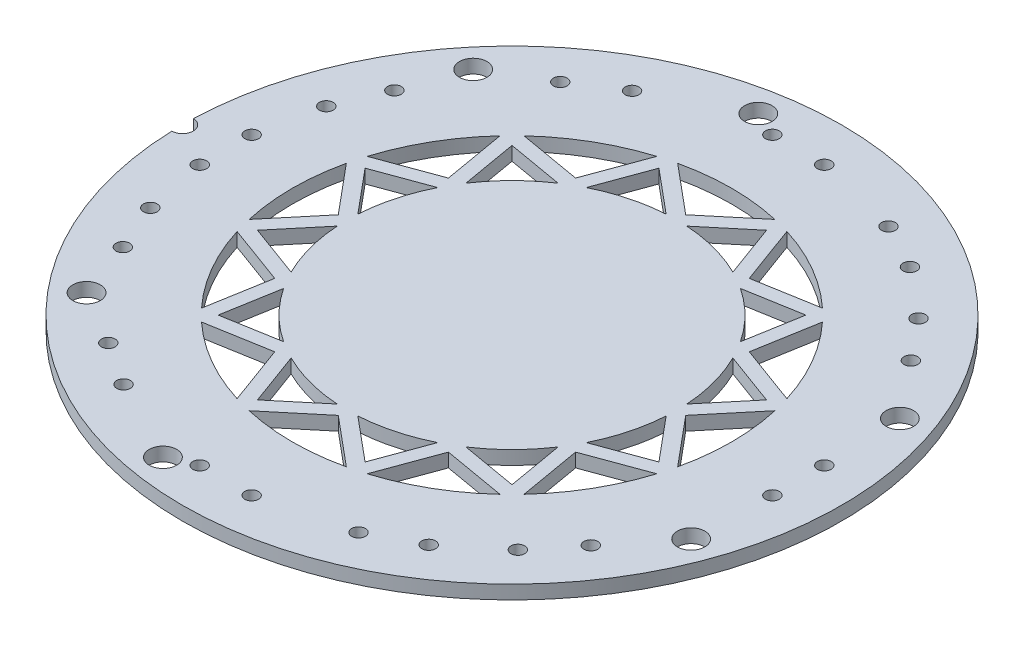
from build123d import *

# Parameters (mm, degrees)
SKETCH2_R                = 88.9
BOSS_EXTRUDE1_DEPTH      = 3.175
SKETCH3_R                = 3.175
CUT_EXTRUDE1_DEPTH       = 3.175
SKETCH6_R                = 88.9
SKETCH6_R_2              = 76.2
CUT_EXTRUDE2_DEPTH       = 126.763669734
SKETCH7_R                = 1.5875
CUT_EXTRUDE3_DEPTH       = 108.809835474
SKETCH8_R                = 2.5
CUT_EXTRUDE4_DEPTH       = 108.809835474
CIRPATTERN1_COUNT        = 2
CIRPATTERN1_ANGLE        = 23
CIRPATTERN2_COUNT        = 2
CIRPATTERN2_ANGLE        = 57
CIRPATTERN3_COUNT        = 2
CIRPATTERN3_ANGLE        = 90
CIRPATTERN4_COUNT        = 2
CIRPATTERN6_COUNT        = 2
CIRPATTERN6_ANGLE        = 141
CIRPATTERN7_COUNT        = 2
CIRPATTERN7_ANGLE        = 118
MIRROR3_COPY_1_SKETCH_R  = 1.5875
MIRROR3_COPY_1_DEPTH     = 108.809835474
MIRROR3_COPY_2_SKETCH_R  = 1.5875
MIRROR3_COPY_2_DEPTH     = 108.809835474
MIRROR3_COPY_3_SKETCH_R  = 1.5875
MIRROR3_COPY_3_DEPTH     = 108.809835474
MIRROR3_COPY_4_SKETCH_R  = 1.5875
MIRROR3_COPY_4_DEPTH     = 108.809835474
MIRROR3_COPY_5_SKETCH_R  = 1.5875
MIRROR3_COPY_5_DEPTH     = 108.809835474
MIRROR3_COPY_6_SKETCH_R  = 1.5875
MIRROR3_COPY_6_DEPTH     = 108.809835474
MIRROR3_COPY_7_SKETCH_R  = 1.5875
MIRROR3_COPY_7_DEPTH     = 108.809835474
MIRROR3_COPY_8_SKETCH_R  = 1.5875
MIRROR3_COPY_8_DEPTH     = 108.809835474
MIRROR3_COPY_9_SKETCH_R  = 1.5875
MIRROR3_COPY_9_DEPTH     = 108.809835474
MIRROR3_COPY_10_SKETCH_R = 1.5875
MIRROR3_COPY_10_DEPTH    = 108.809835474
SKETCH11_R               = 50.8
SKETCH11_R_2             = 38.1
CUT_EXTRUDE6_DEPTH       = 108.809835474
EXTRUDE_THIN2_DEPTH      = 3.175


with BuildPart() as part:
    # Sketch2 → Boss-Extrude1 (new body)
    with BuildSketch(Plane(origin=(0, 0, 0), x_dir=(1, 0, 0), z_dir=(0, 1, 0))):
        with Locations(Location((0, 0, 0), (0, 0, 270))):
            Circle(SKETCH2_R)
    extrude(amount=BOSS_EXTRUDE1_DEPTH)

    # Sketch3 → Cut-Extrude1 (cut)
    with BuildSketch(Plane(origin=(0, 3.175, 0), x_dir=(1, 0, 0), z_dir=(0, 1, 0))):
        with Locations(Location((65.549718535, -24.13, 0), (0, 0, 270))):
            Circle(SKETCH3_R)
        with Locations(Location((65.549718535, 24.13, 0), (0, 0, 270))):
            Circle(SKETCH3_R)
        with Locations(Location((-53.672052261, 44.702721462, 0), (0, 0, 270))):
            Circle(SKETCH3_R)
        with Locations(Location((-11.877666274, 68.832721462, 0), (0, 0, 270))):
            Circle(SKETCH3_R)
        with Locations(Location((-11.877666274, -68.832721462, 0), (0, 0, 270))):
            Circle(SKETCH3_R)
        with Locations(Location((-53.672052261, -44.702721462, 0), (0, 0, 270))):
            Circle(SKETCH3_R)
    extrude(amount=-CUT_EXTRUDE1_DEPTH, mode=Mode.SUBTRACT)

    # Sketch6 → Cut-Extrude2 (cut, through all)
    with BuildSketch(Plane(origin=(0, 3.175, 0), x_dir=(1, 0, 0), z_dir=(0, 1, 0))):
        Circle(SKETCH6_R)
        with Locations(Location((0, 0, 0), (0, 0, 270))):
            Circle(SKETCH6_R_2, mode=Mode.SUBTRACT)
    extrude(amount=-CUT_EXTRUDE2_DEPTH, mode=Mode.SUBTRACT)

    # Sketch7 → Cut-Extrude3 (cut, symmetric)
    with BuildSketch(Plane(origin=(0, 3.175, 0), x_dir=(1, 0, 0), z_dir=(0, 1, 0))):
        with Locations(Location((-66.2, 6, 0), (0, 0, 270))):
            Circle(SKETCH7_R)
        with Locations(Location((-66.2, -6, 0), (0, 0, 270))):
            Circle(SKETCH7_R)
    cut_extrude3 = extrude(amount=CUT_EXTRUDE3_DEPTH, both=True, mode=Mode.SUBTRACT)

    # Sketch8 → Cut-Extrude4 (cut, through all)
    with BuildSketch(Plane(origin=(0, 3.175, 0), x_dir=(1, 0, 0), z_dir=(0, 1, 0))):
        with Locations((-76.2, 0)):
            Circle(SKETCH8_R)
    extrude(amount=-CUT_EXTRUDE4_DEPTH, mode=Mode.SUBTRACT)

    # CirPattern1: Cut-Extrude3 ×2 about axis
    cirpattern1_axis = Axis((0, 0, 0), (0, 1, 0))
    for i in range(1, CIRPATTERN1_COUNT):
        add(cut_extrude3.rotate(cirpattern1_axis, i * CIRPATTERN1_ANGLE / (CIRPATTERN1_COUNT - 1)), mode=Mode.SUBTRACT)

    # CirPattern2: Cut-Extrude3 ×2 about axis
    cirpattern2_axis = Axis((0, 0, 0), (0, 1, 0))
    for i in range(1, CIRPATTERN2_COUNT):
        add(cut_extrude3.rotate(cirpattern2_axis, i * CIRPATTERN2_ANGLE / (CIRPATTERN2_COUNT - 1)), mode=Mode.SUBTRACT)

    # CirPattern3: Cut-Extrude3 ×2 about axis
    cirpattern3_axis = Axis((0, 0, 0), (0, 1, 0))
    for i in range(1, CIRPATTERN3_COUNT):
        add(cut_extrude3.rotate(cirpattern3_axis, i * CIRPATTERN3_ANGLE / (CIRPATTERN3_COUNT - 1)), mode=Mode.SUBTRACT)

    # CirPattern4: Cut-Extrude3 ×2 about axis
    cirpattern4_axis = Axis((0, 0, 0), (0, 1, 0))
    for i in range(1, CIRPATTERN4_COUNT):
        add(cut_extrude3.rotate(cirpattern4_axis, i * 360 / CIRPATTERN4_COUNT), mode=Mode.SUBTRACT)

    # CirPattern6: Cut-Extrude3 ×2 about axis
    cirpattern6_axis = Axis((0, 0, 0), (0, 1, 0))
    for i in range(1, CIRPATTERN6_COUNT):
        add(cut_extrude3.rotate(cirpattern6_axis, i * CIRPATTERN6_ANGLE / (CIRPATTERN6_COUNT - 1)), mode=Mode.SUBTRACT)

    # CirPattern7: Cut-Extrude3 ×2 about axis
    cirpattern7_axis = Axis((0, 0, 0), (0, 1, 0))
    for i in range(1, CIRPATTERN7_COUNT):
        add(cut_extrude3.rotate(cirpattern7_axis, i * CIRPATTERN7_ANGLE / (CIRPATTERN7_COUNT - 1)), mode=Mode.SUBTRACT)

    # Mirror3 copy 1 sketch → Mirror3 copy 1 (cut, symmetric)
    with BuildSketch(Plane(origin=(0, 3.175, 0), x_dir=(0.9205048534524399, 0, 0.3907311284892746), z_dir=(0, 1, 0))):
        with Locations((-66.2, -6)):
            Circle(MIRROR3_COPY_1_SKETCH_R)
        with Locations((-66.2, 6)):
            Circle(MIRROR3_COPY_1_SKETCH_R)
    extrude(amount=MIRROR3_COPY_1_DEPTH, both=True, mode=Mode.SUBTRACT)

    # Mirror3 copy 2 sketch → Mirror3 copy 2 (cut, symmetric)
    with BuildSketch(Plane(origin=(0, 3.175, 0), x_dir=(1, 0, 0), z_dir=(0, 1, 0))):
        with Locations((-66.2, -6)):
            Circle(MIRROR3_COPY_2_SKETCH_R)
        with Locations((-66.2, 6)):
            Circle(MIRROR3_COPY_2_SKETCH_R)
    extrude(amount=MIRROR3_COPY_2_DEPTH, both=True, mode=Mode.SUBTRACT)

    # Mirror3 copy 3 sketch → Mirror3 copy 3 (cut, symmetric)
    with BuildSketch(Plane(origin=(0, 3.175, 0), x_dir=(0.5446390350150256, 0, 0.8386705679454249), z_dir=(0, 1, 0))):
        with Locations((-66.2, -6)):
            Circle(MIRROR3_COPY_3_SKETCH_R)
        with Locations((-66.2, 6)):
            Circle(MIRROR3_COPY_3_SKETCH_R)
    extrude(amount=MIRROR3_COPY_3_DEPTH, both=True, mode=Mode.SUBTRACT)

    # Mirror3 copy 4 sketch → Mirror3 copy 4 (cut, symmetric)
    with BuildSketch(Plane(origin=(0, 3.175, 0), x_dir=(1, 0, 0), z_dir=(0, 1, 0))):
        with Locations((-66.2, -6)):
            Circle(MIRROR3_COPY_4_SKETCH_R)
        with Locations((-66.2, 6)):
            Circle(MIRROR3_COPY_4_SKETCH_R)
    extrude(amount=MIRROR3_COPY_4_DEPTH, both=True, mode=Mode.SUBTRACT)

    # Mirror3 copy 5 sketch → Mirror3 copy 5 (cut, symmetric)
    with BuildSketch(Plane.ZX.offset(3.175)):
        with Locations((-66.2, -6)):
            Circle(MIRROR3_COPY_5_SKETCH_R)
        with Locations((-66.2, 6)):
            Circle(MIRROR3_COPY_5_SKETCH_R)
    extrude(amount=MIRROR3_COPY_5_DEPTH, both=True, mode=Mode.SUBTRACT)

    # Mirror3 copy 6 sketch → Mirror3 copy 6 (cut, symmetric)
    with BuildSketch(Plane(origin=(0, 3.175, 0), x_dir=(1, 0, 0), z_dir=(0, 1, 0))):
        with Locations((-66.2, -6)):
            Circle(MIRROR3_COPY_6_SKETCH_R)
        with Locations((-66.2, 6)):
            Circle(MIRROR3_COPY_6_SKETCH_R)
    extrude(amount=MIRROR3_COPY_6_DEPTH, both=True, mode=Mode.SUBTRACT)

    # Mirror3 copy 7 sketch → Mirror3 copy 7 (cut, symmetric)
    with BuildSketch(Plane(origin=(0, 3.175, 0), x_dir=(-0.7771459614569742, 0, 0.6293203910498333), z_dir=(0, 1, 0))):
        with Locations((-66.2, -6)):
            Circle(MIRROR3_COPY_7_SKETCH_R)
        with Locations((-66.2, 6)):
            Circle(MIRROR3_COPY_7_SKETCH_R)
    extrude(amount=MIRROR3_COPY_7_DEPTH, both=True, mode=Mode.SUBTRACT)

    # Mirror3 copy 8 sketch → Mirror3 copy 8 (cut, symmetric)
    with BuildSketch(Plane(origin=(0, 3.175, 0), x_dir=(1, 0, 0), z_dir=(0, 1, 0))):
        with Locations((-66.2, -6)):
            Circle(MIRROR3_COPY_8_SKETCH_R)
        with Locations((-66.2, 6)):
            Circle(MIRROR3_COPY_8_SKETCH_R)
    extrude(amount=MIRROR3_COPY_8_DEPTH, both=True, mode=Mode.SUBTRACT)

    # Mirror3 copy 9 sketch → Mirror3 copy 9 (cut, symmetric)
    with BuildSketch(Plane(origin=(0, 3.175, 0), x_dir=(-0.46947156278589486, 0, 0.8829475928589248), z_dir=(0, 1, 0))):
        with Locations((-66.2, -6)):
            Circle(MIRROR3_COPY_9_SKETCH_R)
        with Locations((-66.2, 6)):
            Circle(MIRROR3_COPY_9_SKETCH_R)
    extrude(amount=MIRROR3_COPY_9_DEPTH, both=True, mode=Mode.SUBTRACT)

    # Mirror3 copy 10 sketch → Mirror3 copy 10 (cut, symmetric)
    with BuildSketch(Plane(origin=(0, 3.175, 0), x_dir=(1, 0, 0), z_dir=(0, 1, 0))):
        with Locations((-66.2, -6)):
            Circle(MIRROR3_COPY_10_SKETCH_R)
        with Locations((-66.2, 6)):
            Circle(MIRROR3_COPY_10_SKETCH_R)
    extrude(amount=MIRROR3_COPY_10_DEPTH, both=True, mode=Mode.SUBTRACT)

    # Sketch11 → Cut-Extrude6 (cut, through all)
    with BuildSketch(Plane(origin=(0, 3.175, 0), x_dir=(1, 0, 0), z_dir=(0, 1, 0))):
        with Locations(Location((0, 0, 0), (0, 0, 270))):
            Circle(SKETCH11_R)
        with Locations(Location((0, 0, 0), (0, 0, 270))):
            Circle(SKETCH11_R_2, mode=Mode.SUBTRACT)
    extrude(amount=-CUT_EXTRUDE6_DEPTH, mode=Mode.SUBTRACT)


with BuildPart() as cut_extrude6_piece_1:
    # of the separate pieces the step leaves, piece 1, a body of its own (cut_extrude6_pieces)
    add(part.part.solids().sort_by_distance((-76.158989501, 0, 2.499663605))[0])



with BuildPart() as cut_extrude6_piece_2:
    # of the separate pieces the step leaves, piece 2, a body of its own (cut_extrude6_pieces)
    add(part.part.solids().sort_by_distance((0, 0, 38.1))[0])


with BuildPart() as cut_extrude6_piece_1_1:
    add(cut_extrude6_piece_1.part)

    add(cut_extrude6_piece_2.part)  # Extrude-Thin2 merges Cut-Extrude6 piece 2
    # Sketch12 → Extrude-Thin2 (add)
    with BuildSketch(Plane(origin=(0, 3.175, 0), x_dir=(1, 0, 0), z_dir=(0, 1, 0))):
        Polygon((-51.731661279, -13.861456863), (-34.786003978, -20.083708761), (-37.870204416, -37.870204416), (-20.083708761, -34.786003978), (-13.861456863, -51.731661279), (0, -40.167417522), (13.861456863, -51.731661279), (20.083708761, -34.786003978), (37.870204416, -37.870204416), (34.786003978, -20.083708761), (51.731661279, -13.861456863), (40.167417522, 0), (51.731661279, 13.861456863), (34.786003978, 20.083708761), (37.870204416, 37.870204416), (20.083708761, 34.786003978), (13.861456863, 51.731661279), (0, 40.167417522), (-13.861456863, 51.731661279), (-20.083708761, 34.786003978), (-37.870204416, 37.870204416), (-34.786003978, 20.083708761), (-51.731661279, 13.861456863), (-40.167417522, 0), align=None)
        Polygon((-46.406402672, -12.434558119), (-31.20513179, -18.016291239), (-33.971844552, -33.971844552), (-18.016291239, -31.20513179), (-12.434558119, -46.406402672), (0, -36.032582478), (12.434558119, -46.406402672), (18.016291239, -31.20513179), (33.971844552, -33.971844552), (31.20513179, -18.016291239), (46.406402672, -12.434558119), (36.032582478, 0), (46.406402672, 12.434558119), (31.20513179, 18.016291239), (33.971844552, 33.971844552), (18.016291239, 31.20513179), (12.434558119, 46.406402672), (0, 36.032582478), (-12.434558119, 46.406402672), (-18.016291239, 31.20513179), (-33.971844552, 33.971844552), (-31.20513179, 18.016291239), (-46.406402672, 12.434558119), (-36.032582478, 0), align=None, mode=Mode.SUBTRACT)
    extrude(amount=-EXTRUDE_THIN2_DEPTH)


solid = cut_extrude6_piece_1_1.part
